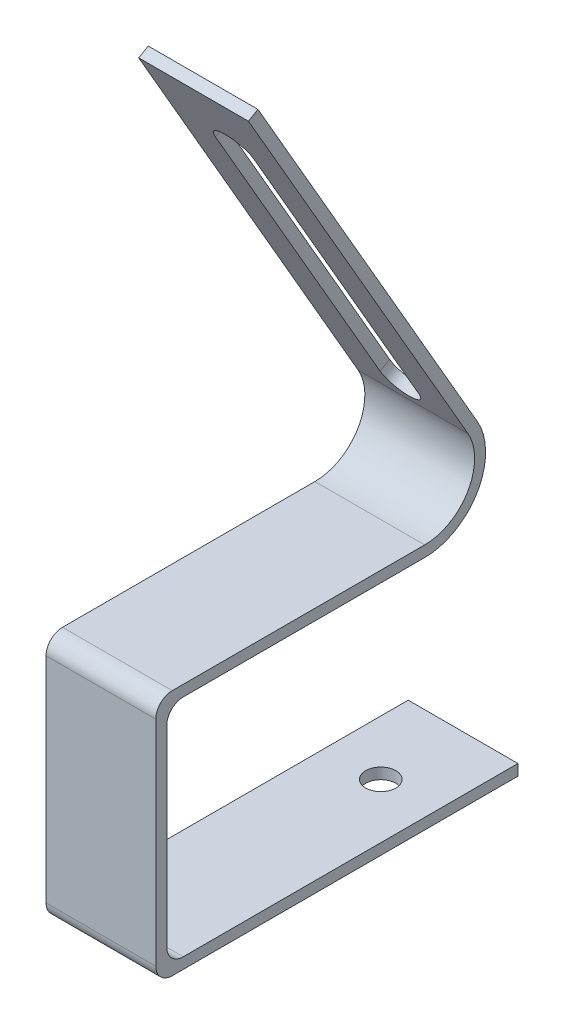
from build123d import *

# Parameters (mm, degrees)
RESSALTO_EXTRUS_O4_DEPTH = 20
FILETE1_R                = 3
ESBO_O5_R                = 2.75
CORTE_EXTRUS_O1_DEPTH    = 2
CORTE_EXTRUS_O2_DEPTH    = 2


with BuildPart() as part:
    # Esboço4 → Ressalto-extrusão4 (new body)
    with BuildSketch(Plane(origin=(0, 0, 0), x_dir=(0, 0, -1), z_dir=(1, 0, 0))):
        with BuildLine():
            Line((0, 0), (66, 0))
            Line((66, 0), (66, 2))
            Line((66, 2), (2, 2))
            Line((2, 2), (2, 43))
            Line((2, 43), (49, 43))
            ThreePointArc((49, 43), (58.614151216, 48.550732793), (58.614151216, 59.652198378))
            Line((58.614151216, 59.652198378), (18.614151216, 128.93423068))
            Line((18.614151216, 128.93423068), (16.882100408, 127.93423068))
            Line((16.882100408, 127.93423068), (56.882100408, 58.652198378))
            ThreePointArc((56.882100408, 58.652198378), (56.882100408, 49.550732793), (49, 45))
            Line((49, 45), (0, 45))
            Line((0, 45), (0, 0))
        make_face()
    extrude(amount=RESSALTO_EXTRUS_O4_DEPTH)

    # Filete1
    filete1_edges = [part.edges().sort_by_distance(p)[0] for p in [
        (10, 45, 0),
        (10, 43, -2),
        (10, 2, -2),
        (10, 0, 0),
    ]]
    fillet(filete1_edges, radius=FILETE1_R)

    # Esboço5 → Corte-extrusão1 (cut)
    with BuildSketch(Plane.XZ):
        with Locations(Location((10, -51, 0), (0, 0, 270))):
            Circle(ESBO_O5_R)
    extrude(amount=-CORTE_EXTRUS_O1_DEPTH, mode=Mode.SUBTRACT)

    # Esboço6 → Corte-extrusão2 (cut)
    with BuildSketch(Plane(origin=(0, 40.293721582, -69.790773005), x_dir=(-1, 0, 0), z_dir=(0, 0.4999999999999983, -0.8660254037844398))):
        with BuildLine():
            Line((-13.5, 87.353243579), (-13.5, 27.353243579))
            ThreePointArc((-13.5, 27.353243579), (-10, 23.853243579), (-6.5, 27.353243579))
            Line((-6.5, 27.353243579), (-6.5, 87.353243579))
            ThreePointArc((-6.5, 87.353243579), (-10, 90.853243579), (-13.5, 87.353243579))
        make_face()
    extrude(amount=-CORTE_EXTRUS_O2_DEPTH, mode=Mode.SUBTRACT)


solid = part.part
